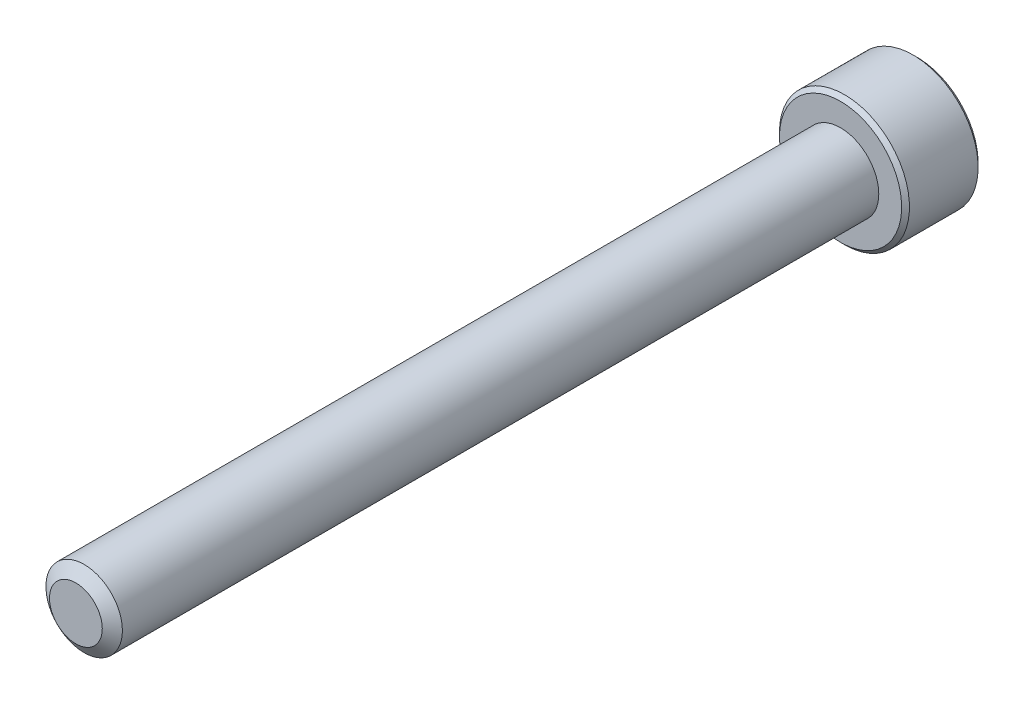
from build123d import *

# Parameters (mm, degrees)
SKETCH1_R          = 2.5
EXTRUDE1_DEPTH     = 50
SKETCH6_R          = 4.25
EXTRUDE2_DEPTH     = 5
CUT_EXTRUDE1_DEPTH = 3
CHAMFER1_SIZE      = 0.255


with BuildPart() as part:
    # Sketch1 → Extrude1 (new body)
    with BuildSketch(Plane.XY):
        Circle(SKETCH1_R)
    extrude(amount=-EXTRUDE1_DEPTH)

    # Sketch4 → Cut-Revolve1 (revolve, cut)
    with BuildSketch(Plane(origin=(0, 0, 0), x_dir=(0, 0, -1), z_dir=(1, 0, 0))):
        Polygon((0.541691224, 2.5), (0, 1.726384758), (0, 2.5), align=None)
    revolve(axis=Axis((0, 0, 0), (0, 0, -1)), mode=Mode.SUBTRACT)

    # Sketch6 → Extrude2 (add)
    with BuildSketch(Plane(origin=(0, 0, -50), x_dir=(-1, 0, 0), z_dir=(0, 0, -1))):
        Circle(SKETCH6_R)
    extrude(amount=EXTRUDE2_DEPTH)

    # Sketch7 → Cut-Extrude1 (cut)
    with BuildSketch(Plane(origin=(0, 0, -55), x_dir=(-1, 0, 0), z_dir=(0, 0, -1))):
        Polygon((0, 2.309401077), (-2, 1.154700538), (-2, -1.154700538), (0, -2.309401077), (2, -1.154700538), (2, 1.154700538), align=None)
    extrude(amount=-CUT_EXTRUDE1_DEPTH, mode=Mode.SUBTRACT)

    # Cut-Extrude2 cone 1 section (through the dimple's axis) → Cut-Extrude2 (revolve, cut)
    with BuildSketch(Plane(origin=(0, 0, -55), x_dir=(0, 1, 0), z_dir=(1, 0, 0))):
        Polygon((0, 0), (2.309401077, 0), (0, 2.309401077), align=None)
    revolve(axis=Axis((0, 0, -55), (0, 0, 1)), mode=Mode.SUBTRACT)

    # Chamfer1
    chamfer1_edges = [part.edges().sort_by_distance(p)[0] for p in [
        (4.25, 0, -55),
        (4.25, 0, -50),
    ]]
    chamfer(chamfer1_edges, length=CHAMFER1_SIZE)

    # Sketch10 → Revolve1 (revolve)
    with BuildSketch(Plane(origin=(0, 0, 0), x_dir=(0, 0, -1), z_dir=(1, 0, 0))):
        Polygon((50, 2.5), (50, 0), (48.764466094, 0), (49.8, 2.5), align=None)
    revolve(axis=Axis((0, 0, -50), (0, 0, 1)))


solid = part.part
